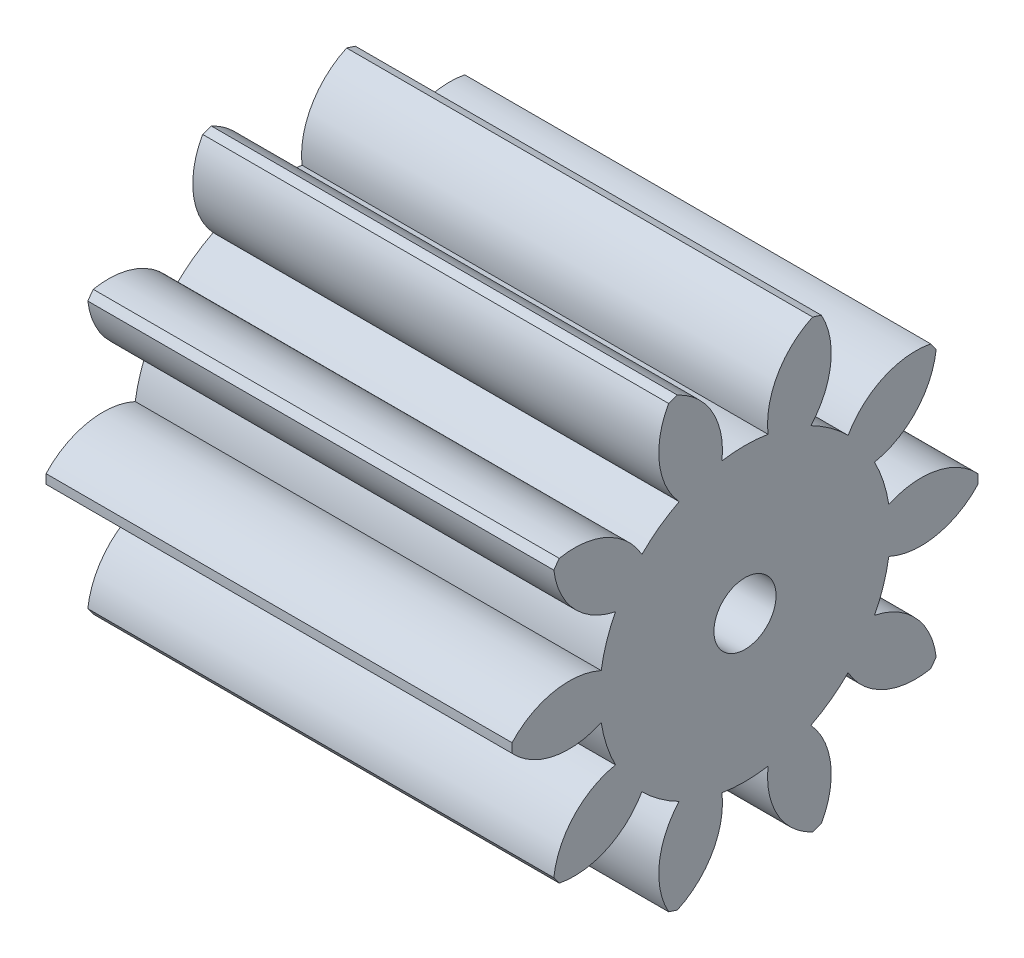
from build123d import *

# Parameters (mm, degrees)
BASPROSKE_W     = 6
BASPROSKE_H     = 3
TOOTHCUT_DEPTH  = 8.348469228
TEETHCUTS_COUNT = 10
TEETHCUTS_ANGLE = 324
BORSKE_R        = 0.4
BORE_DEPTH      = 50.0000508


with BuildPart() as part:
    # BasProSke → Base-Revolve (revolve)
    with BuildSketch(Plane(origin=(0, 0, 0), x_dir=(1, 0, 0), z_dir=(0, 1, 0)), mode=Mode.PRIVATE) as base_revolve_sk:
        with Locations((3, 1.5)):
            Rectangle(BASPROSKE_W, BASPROSKE_H)
    revolve(base_revolve_sk.sketch.rotate(Axis((-10, 0, 0), (1, 0, 0)), 180), axis=Axis((-10, 0, 0), (1, 0, 0)))

    # TooCutSke → ToothCut (cut, through all)
    with BuildSketch(Plane(origin=(0, 0, 0), x_dir=(0, 0, -1), z_dir=(1, 0, 0))):
        with BuildLine():
            ThreePointArc((0.296449938, 1.850403587), (0, 1.874), (-0.296449938, 1.850403587))
            ThreePointArc((-0.296449938, 1.850403587), (-0.428089565, 2.470295585), (-0.905889751, 2.886591228))
            ThreePointArc((-0.905889751, 2.886591228), (0, 3.0254), (0.905889751, 2.886591228))
            ThreePointArc((0.905889751, 2.886591228), (0.428089565, 2.470295585), (0.296449938, 1.850403587))
        make_face()
    toothcut = extrude(amount=TOOTHCUT_DEPTH, mode=Mode.SUBTRACT)

    # TeethCuts: ToothCut ×10 about axis
    teethcuts_axis = Axis((-10, 0, 0), (1, 0, 0))
    for i in range(1, TEETHCUTS_COUNT):
        add(toothcut.rotate(teethcuts_axis, i * TEETHCUTS_ANGLE / (TEETHCUTS_COUNT - 1)), mode=Mode.SUBTRACT)

    # BorSke → Bore (cut, symmetric)
    with BuildSketch(Plane(origin=(0, 0, 0), x_dir=(0, 0, -1), z_dir=(1, 0, 0))):
        with Locations(Location((0, 0, 0), (0, 0, 180))):
            Circle(BORSKE_R)
    extrude(amount=BORE_DEPTH, both=True, mode=Mode.SUBTRACT)


solid = part.part
